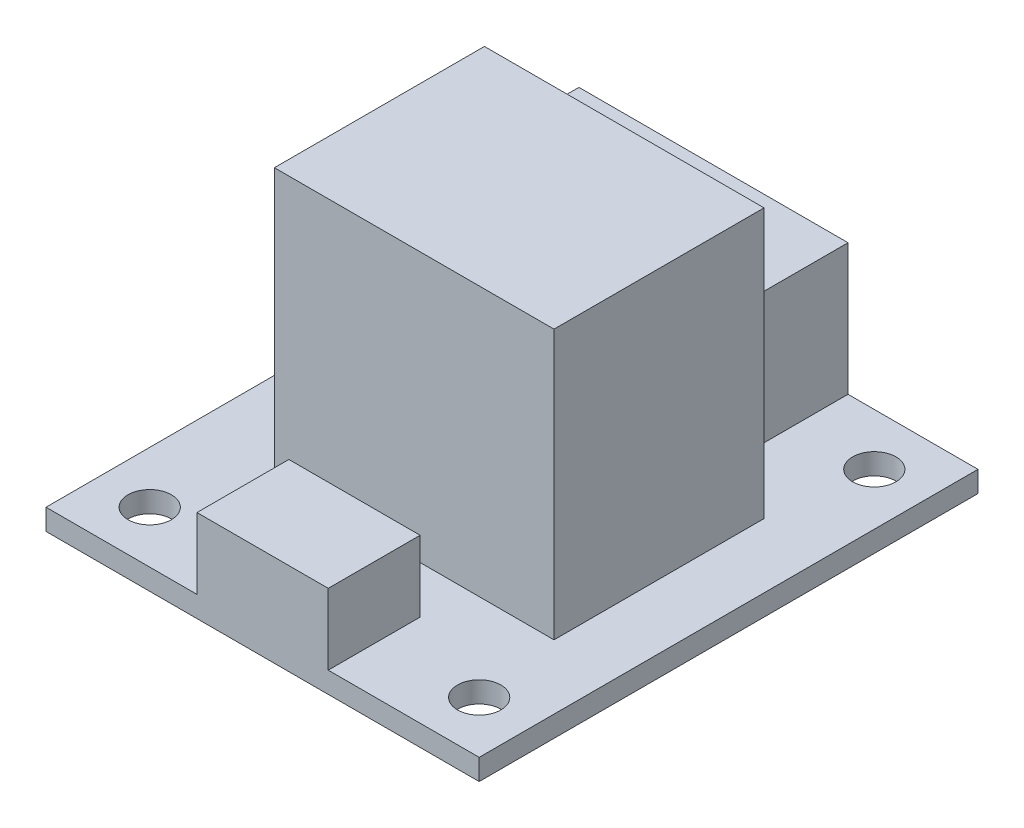
from build123d import *

# Parameters (mm, degrees)
SKETCH1_W           = 33
SKETCH1_H           = 38
BOSS_EXTRUDE1_DEPTH = 1.6
SKETCH2_R           = 1.65
CUT_EXTRUDE1_DEPTH  = 1.6
SKETCH3_W           = 10
SKETCH3_H           = 7
BOSS_EXTRUDE2_DEPTH = 5.4
SKETCH4_W           = 21.3
SKETCH4_H           = 16
BOSS_EXTRUDE3_DEPTH = 20.5
SKETCH5_W           = 20.5
SKETCH5_H           = 8.3
BOSS_EXTRUDE4_DEPTH = 10


with BuildPart() as part:
    # Sketch1 → Boss-Extrude1 (new body)
    with BuildSketch(Plane(origin=(0, 0, 0), x_dir=(1, 0, 0), z_dir=(0, 1, 0))):
        with Locations((16.5, 19)):
            Rectangle(SKETCH1_W, SKETCH1_H)
    extrude(amount=BOSS_EXTRUDE1_DEPTH)

    # Sketch2 → Cut-Extrude1 (cut)
    with BuildSketch(Plane(origin=(0, 1.6, 0), x_dir=(1, 0, 0), z_dir=(0, 1, 0))):
        with Locations(Location((29.05, 3.95, 0), (0, 0, 270))):
            Circle(SKETCH2_R)
        with Locations(Location((3.95, 3.95, 0), (0, 0, 90))):
            Circle(SKETCH2_R)
        with Locations(Location((29.05, 34.05, 0), (0, 0, 90))):
            Circle(SKETCH2_R)
    extrude(amount=-CUT_EXTRUDE1_DEPTH, mode=Mode.SUBTRACT)

    # Sketch3 → Boss-Extrude2 (add)
    with BuildSketch(Plane(origin=(0, 1.6, 0), x_dir=(1, 0, 0), z_dir=(0, 1, 0))):
        with Locations((16.5, 3.5)):
            Rectangle(SKETCH3_W, SKETCH3_H)
    extrude(amount=BOSS_EXTRUDE2_DEPTH)

    # Sketch4 → Boss-Extrude3 (add)
    with BuildSketch(Plane(origin=(0, 1.6, 0), x_dir=(1, 0, 0), z_dir=(0, 1, 0))):
        with Locations((17.45, 18.6)):
            Rectangle(SKETCH4_W, SKETCH4_H)
    extrude(amount=BOSS_EXTRUDE3_DEPTH)

    # Sketch5 → Boss-Extrude4 (add)
    with BuildSketch(Plane(origin=(0, 1.6, 0), x_dir=(1, 0, 0), z_dir=(0, 1, 0))):
        with Locations((12.85, 33.85)):
            Rectangle(SKETCH5_W, SKETCH5_H)
    extrude(amount=BOSS_EXTRUDE4_DEPTH)


solid = part.part
